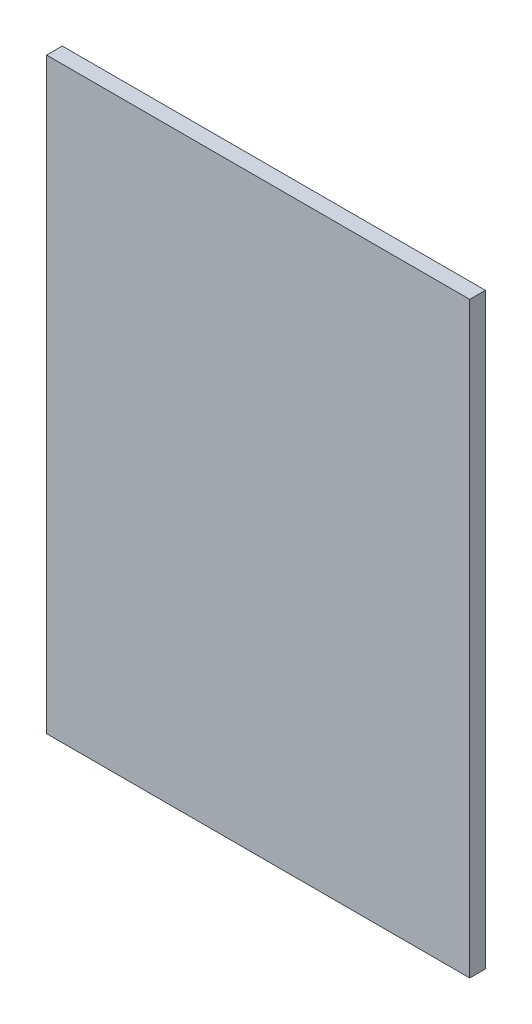
from build123d import *

# Parameters (mm, degrees)
SKETCH1_W           = 108
SKETCH1_H           = 150
BOSS_EXTRUDE1_DEPTH = 4


with BuildPart() as part:
    # Sketch1 → Boss-Extrude1 (new body)
    with BuildSketch(Plane.XY):
        with Locations((6.345323741, 37.025179856)):
            Rectangle(SKETCH1_W, SKETCH1_H)
    extrude(amount=BOSS_EXTRUDE1_DEPTH)


solid = part.part
